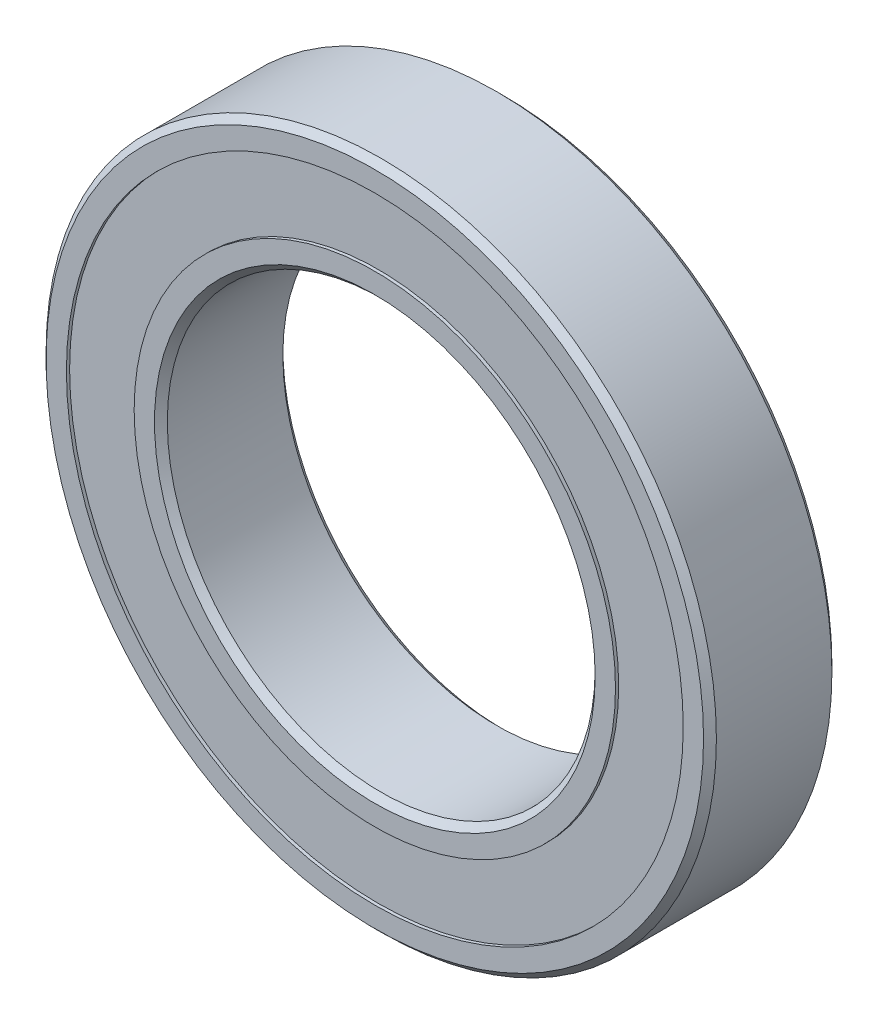
from build123d import *

# Parameters (mm, degrees)
CIRPATTERN1_COUNT = 12
SKETCH5_W         = 1.170064413
SKETCH5_H         = 4.75


with BuildPart() as part:
    # Sketch3 → Revolve1 (revolve)
    with BuildSketch(Plane(origin=(0, 0, 0), x_dir=(0, 0, -1), z_dir=(1, 0, 0)), mode=Mode.PRIVATE) as revolve1_sk:
        with BuildLine():
            Line((-4.5, 23.05), (-4.5, 21.62475))
            Line((-4.5, 21.62475), (-2, 21.62475))
            ThreePointArc((-2, 21.62475), (0, 22.354685587), (2, 21.62475))
            Line((2, 21.62475), (4.5, 21.62475))
            Line((4.5, 21.62475), (4.5, 23.05))
            Line((4.5, 23.05), (4.05, 23.5))
            Line((4.05, 23.5), (-4.05, 23.5))
            Line((-4.05, 23.5), (-4.5, 23.05))
        make_face()
        with BuildLine():
            Line((-4.5, 15.4495), (-4.5, 16.87475))
            Line((-4.5, 16.87475), (-2, 16.87475))
            ThreePointArc((-2, 16.87475), (0, 16.144814413), (2, 16.87475))
            Line((2, 16.87475), (4.5, 16.87475))
            Line((4.5, 16.87475), (4.5, 15.4495))
            Line((4.5, 15.4495), (4.05, 14.9995))
            Line((4.05, 14.9995), (-4.05, 14.9995))
            Line((-4.05, 14.9995), (-4.5, 15.4495))
        make_face()
    revolve(revolve1_sk.sketch.rotate(Axis((0, 0, 4.5), (0, 0, -1)), 90), axis=Axis((0, 0, 4.5), (0, 0, -1)))


with BuildPart() as body_2:
    # Sketch4 → Revolve2 (revolve)
    with BuildSketch(Plane(origin=(0, 0, 0), x_dir=(0, 0, -1), z_dir=(1, 0, 0))):
        with BuildLine():
            Line((-3.104935587, 19.24975), (3.104935587, 19.24975))
            ThreePointArc((3.104935587, 19.24975), (0, 22.354685587), (-3.104935587, 19.24975))
        make_face()
    revolve(axis=Axis((0, 19.24975, 3.104935587), (0, 0, -1)))


with BuildPart() as cirpattern1_1:
    # CirPattern1: pattern copy
    add(body_2.part.rotate(Axis((0, 0, 0), (0, 0, 1)), 1 * 360 / CIRPATTERN1_COUNT))


with BuildPart() as cirpattern1_2:
    # CirPattern1: pattern copy
    add(body_2.part.rotate(Axis((0, 0, 0), (0, 0, 1)), 2 * 360 / CIRPATTERN1_COUNT))


with BuildPart() as cirpattern1_3:
    # CirPattern1: pattern copy
    add(body_2.part.rotate(Axis((0, 0, 0), (0, 0, 1)), 3 * 360 / CIRPATTERN1_COUNT))


with BuildPart() as cirpattern1_4:
    # CirPattern1: pattern copy
    add(body_2.part.rotate(Axis((0, 0, 0), (0, 0, 1)), 4 * 360 / CIRPATTERN1_COUNT))


with BuildPart() as cirpattern1_5:
    # CirPattern1: pattern copy
    add(body_2.part.rotate(Axis((0, 0, 0), (0, 0, 1)), 5 * 360 / CIRPATTERN1_COUNT))


with BuildPart() as cirpattern1_6:
    # CirPattern1: pattern copy
    add(body_2.part.rotate(Axis((0, 0, 0), (0, 0, 1)), 6 * 360 / CIRPATTERN1_COUNT))


with BuildPart() as cirpattern1_7:
    # CirPattern1: pattern copy
    add(body_2.part.rotate(Axis((0, 0, 0), (0, 0, 1)), 7 * 360 / CIRPATTERN1_COUNT))


with BuildPart() as cirpattern1_8:
    # CirPattern1: pattern copy
    add(body_2.part.rotate(Axis((0, 0, 0), (0, 0, 1)), 8 * 360 / CIRPATTERN1_COUNT))


with BuildPart() as cirpattern1_9:
    # CirPattern1: pattern copy
    add(body_2.part.rotate(Axis((0, 0, 0), (0, 0, 1)), 9 * 360 / CIRPATTERN1_COUNT))


with BuildPart() as cirpattern1_10:
    # CirPattern1: pattern copy
    add(body_2.part.rotate(Axis((0, 0, 0), (0, 0, 1)), 10 * 360 / CIRPATTERN1_COUNT))


with BuildPart() as cirpattern1_11:
    # CirPattern1: pattern copy
    add(body_2.part.rotate(Axis((0, 0, 0), (0, 0, 1)), 11 * 360 / CIRPATTERN1_COUNT))


with BuildPart() as body_14:
    # Sketch5 → Revolve3 (revolve)
    with BuildSketch(Plane(origin=(0, 0, 0), x_dir=(0, 0, -1), z_dir=(1, 0, 0)), mode=Mode.PRIVATE) as revolve3_sk:
        with Locations((-3.689967794, 19.24975)):
            Rectangle(SKETCH5_W, SKETCH5_H)
        with Locations((3.689967794, 19.24975)):
            Rectangle(SKETCH5_W, SKETCH5_H)
    revolve(revolve3_sk.sketch.rotate(Axis((0, 0, 4.5), (0, 0, -1)), 90), axis=Axis((0, 0, 4.5), (0, 0, -1)))


solid = Compound([part.part, body_2.part, cirpattern1_1.part, cirpattern1_2.part, cirpattern1_3.part, cirpattern1_4.part, cirpattern1_5.part, cirpattern1_6.part, cirpattern1_7.part, cirpattern1_8.part, cirpattern1_9.part, cirpattern1_10.part, cirpattern1_11.part, body_14.part])
